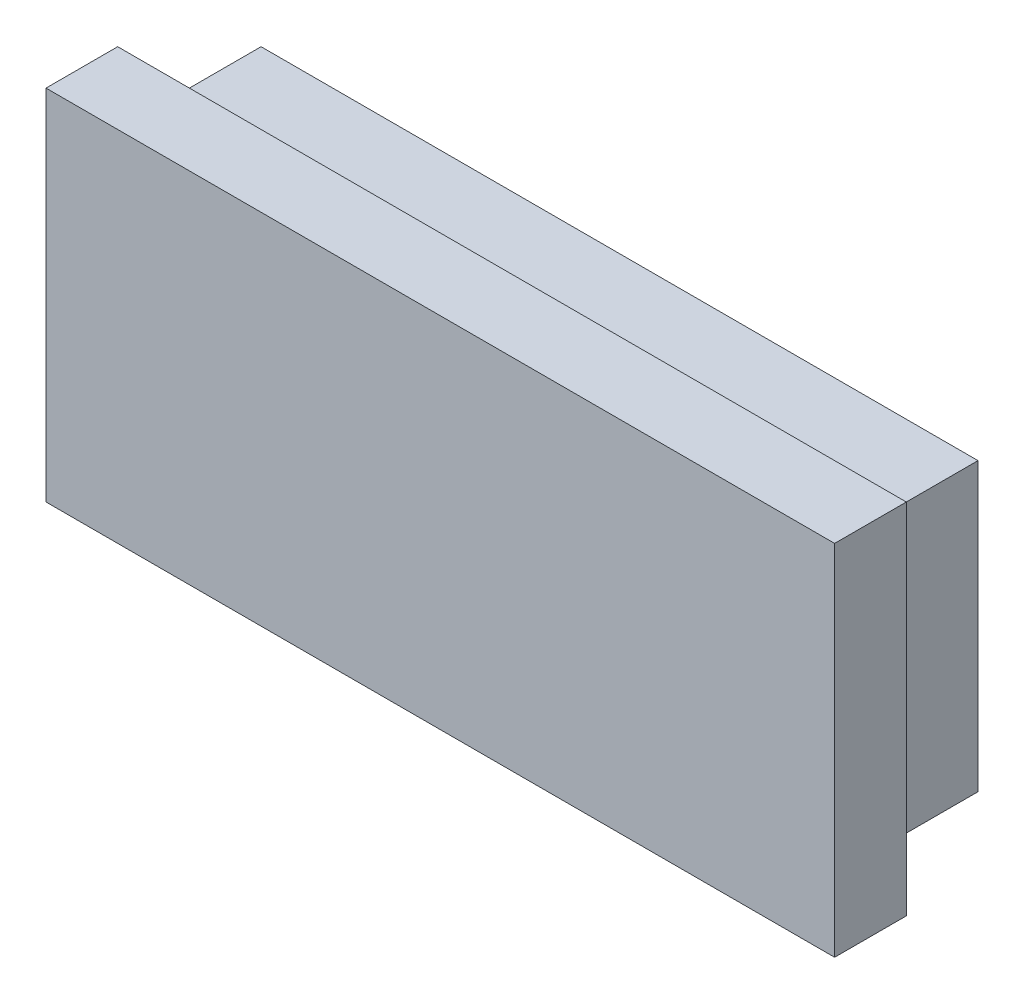
from build123d import *

# Parameters (mm, degrees)
SKETCH1_W           = 12.7
SKETCH1_H           = 5.08
BOSS_EXTRUDE1_DEPTH = 1.27
SKETCH2_W           = 13.97
SKETCH2_H           = 6.35
BOSS_EXTRUDE2_DEPTH = 0.635


with BuildPart() as part:
    # Sketch1 → Boss-Extrude1 (new, symmetric)
    with BuildSketch(Plane.XY):
        Rectangle(SKETCH1_W, SKETCH1_H)
    extrude(amount=BOSS_EXTRUDE1_DEPTH, both=True)

    # Sketch2 → Boss-Extrude2 (add, symmetric)
    with BuildSketch(Plane.XY.offset(1.27)):
        Rectangle(SKETCH2_W, SKETCH2_H)
    extrude(amount=BOSS_EXTRUDE2_DEPTH, both=True)


solid = part.part
